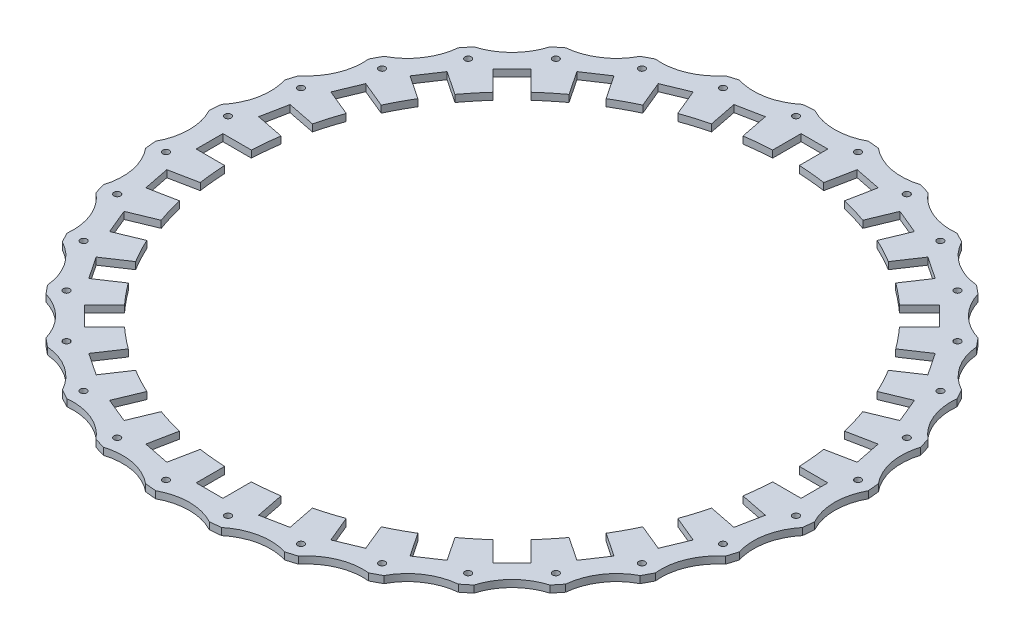
from build123d import *

# Parameters (mm, degrees)
BOSS_EXTRUDE1_DEPTH = 3.175
SKETCH4_R           = 1.4732
CUT_EXTRUDE1_DEPTH  = 211.364711432
CIRPATTERN1_COUNT   = 32


with BuildPart() as part:
    # Sketch1 → Boss-Extrude1 (new body)
    with BuildSketch(Plane(origin=(0, 0, 0), x_dir=(1, 0, 0), z_dir=(0, 1, 0))):
        with BuildLine():
            ThreePointArc((148.73337082, -12.1031), (145.664402376, 0), (148.73337082, 12.1031))
            ThreePointArc((148.73337082, 12.1031), (148.506440838, 14.626607766), (148.236698481, 17.145898881))
            ThreePointArc((148.236698481, 17.145898881), (142.86550173, 28.417715166), (143.514303128, 40.886983535))
            ThreePointArc((143.514303128, 40.886983535), (142.7994216, 43.317730963), (142.043372952, 45.735990483))
            ThreePointArc((142.043372952, 45.735990483), (134.576359971, 55.743353475), (132.780061251, 68.099603222))
            ThreePointArc((132.780061251, 68.099603222), (131.604700672, 70.344178053), (130.391400259, 72.568473619))
            ThreePointArc((130.391400259, 72.568473619), (121.11552417, 80.926805971), (116.943156085, 92.695193349))
            ThreePointArc((116.943156085, 92.695193349), (115.352484903, 94.667337829), (113.728559179, 96.612191012))
            ThreePointArc((113.728559179, 96.612191012), (103.000286698, 103.000286698), (96.612191012, 113.728559179))
            ThreePointArc((96.612191012, 113.728559179), (94.667337829, 115.352484903), (92.695193349, 116.943156085))
            ThreePointArc((92.695193349, 116.943156085), (80.926805971, 121.11552417), (72.568473619, 130.391400259))
            ThreePointArc((72.568473619, 130.391400259), (70.344178053, 131.604700672), (68.099603222, 132.780061251))
            ThreePointArc((68.099603222, 132.780061251), (55.743353475, 134.576359971), (45.735990483, 142.043372952))
            ThreePointArc((45.735990483, 142.043372952), (43.317730963, 142.7994216), (40.886983535, 143.514303128))
            ThreePointArc((40.886983535, 143.514303128), (28.417715166, 142.86550173), (17.145898881, 148.236698481))
            ThreePointArc((17.145898881, 148.236698481), (14.626607766, 148.506440838), (12.1031, 148.73337082))
            ThreePointArc((12.1031, 148.73337082), (0, 145.664402376), (-12.1031, 148.73337082))
            ThreePointArc((-12.1031, 148.73337082), (-14.626607766, 148.506440838), (-17.145898881, 148.236698481))
            ThreePointArc((-17.145898881, 148.236698481), (-28.417715166, 142.86550173), (-40.886983535, 143.514303128))
            ThreePointArc((-40.886983535, 143.514303128), (-43.317730963, 142.7994216), (-45.735990483, 142.043372952))
            ThreePointArc((-45.735990483, 142.043372952), (-55.743353475, 134.576359971), (-68.099603222, 132.780061251))
            ThreePointArc((-68.099603222, 132.780061251), (-70.344178053, 131.604700672), (-72.568473619, 130.391400259))
            ThreePointArc((-72.568473619, 130.391400259), (-80.926805971, 121.11552417), (-92.695193349, 116.943156085))
            ThreePointArc((-92.695193349, 116.943156085), (-94.667337829, 115.352484903), (-96.612191012, 113.728559179))
            ThreePointArc((-96.612191012, 113.728559179), (-103.000286698, 103.000286698), (-113.728559179, 96.612191012))
            ThreePointArc((-113.728559179, 96.612191012), (-115.352484903, 94.667337829), (-116.943156085, 92.695193349))
            ThreePointArc((-116.943156085, 92.695193349), (-121.11552417, 80.926805971), (-130.391400259, 72.568473619))
            ThreePointArc((-130.391400259, 72.568473619), (-131.604700672, 70.344178053), (-132.780061251, 68.099603222))
            ThreePointArc((-132.780061251, 68.099603222), (-134.576359971, 55.743353475), (-142.043372952, 45.735990483))
            ThreePointArc((-142.043372952, 45.735990483), (-142.7994216, 43.317730963), (-143.514303128, 40.886983535))
            ThreePointArc((-143.514303128, 40.886983535), (-142.86550173, 28.417715166), (-148.236698481, 17.145898881))
            ThreePointArc((-148.236698481, 17.145898881), (-148.506440838, 14.626607766), (-148.73337082, 12.1031))
            ThreePointArc((-148.73337082, 12.1031), (-145.664402376, 0), (-148.73337082, -12.1031))
            ThreePointArc((-148.73337082, -12.1031), (-148.506440838, -14.626607766), (-148.236698481, -17.145898881))
            ThreePointArc((-148.236698481, -17.145898881), (-142.86550173, -28.417715166), (-143.514303128, -40.886983535))
            ThreePointArc((-143.514303128, -40.886983535), (-142.7994216, -43.317730963), (-142.043372952, -45.735990483))
            ThreePointArc((-142.043372952, -45.735990483), (-134.576359971, -55.743353475), (-132.780061251, -68.099603222))
            ThreePointArc((-132.780061251, -68.099603222), (-131.604700672, -70.344178053), (-130.391400259, -72.568473619))
            ThreePointArc((-130.391400259, -72.568473619), (-121.11552417, -80.926805971), (-116.943156085, -92.695193349))
            ThreePointArc((-116.943156085, -92.695193349), (-115.352484903, -94.667337829), (-113.728559179, -96.612191012))
            ThreePointArc((-113.728559179, -96.612191012), (-103.000286698, -103.000286698), (-96.612191012, -113.728559179))
            ThreePointArc((-96.612191012, -113.728559179), (-94.667337829, -115.352484903), (-92.695193349, -116.943156085))
            ThreePointArc((-92.695193349, -116.943156085), (-80.926805971, -121.11552417), (-72.568473619, -130.391400259))
            ThreePointArc((-72.568473619, -130.391400259), (-70.344178053, -131.604700672), (-68.099603222, -132.780061251))
            ThreePointArc((-68.099603222, -132.780061251), (-55.743353475, -134.576359971), (-45.735990483, -142.043372952))
            ThreePointArc((-45.735990483, -142.043372952), (-43.317730963, -142.7994216), (-40.886983535, -143.514303128))
            ThreePointArc((-40.886983535, -143.514303128), (-28.417715166, -142.86550173), (-17.145898881, -148.236698481))
            ThreePointArc((-17.145898881, -148.236698481), (-14.626607766, -148.506440838), (-12.1031, -148.73337082))
            ThreePointArc((-12.1031, -148.73337082), (0, -145.664402376), (12.1031, -148.73337082))
            ThreePointArc((12.1031, -148.73337082), (14.626607766, -148.506440838), (17.145898881, -148.236698481))
            ThreePointArc((17.145898881, -148.236698481), (28.417715166, -142.86550173), (40.886983535, -143.514303128))
            ThreePointArc((40.886983535, -143.514303128), (43.317730963, -142.7994216), (45.735990483, -142.043372952))
            ThreePointArc((45.735990483, -142.043372952), (55.743353475, -134.576359971), (68.099603222, -132.780061251))
            ThreePointArc((68.099603222, -132.780061251), (70.344178053, -131.604700672), (72.568473619, -130.391400259))
            ThreePointArc((72.568473619, -130.391400259), (80.926805971, -121.11552417), (92.695193349, -116.943156085))
            ThreePointArc((92.695193349, -116.943156085), (94.667337829, -115.352484903), (96.612191012, -113.728559179))
            ThreePointArc((96.612191012, -113.728559179), (103.000286698, -103.000286698), (113.728559179, -96.612191012))
            ThreePointArc((113.728559179, -96.612191012), (115.352484903, -94.667337829), (116.943156085, -92.695193349))
            ThreePointArc((116.943156085, -92.695193349), (121.11552417, -80.926805971), (130.391400259, -72.568473619))
            ThreePointArc((130.391400259, -72.568473619), (131.604700672, -70.344178053), (132.780061251, -68.099603222))
            ThreePointArc((132.780061251, -68.099603222), (134.576359971, -55.743353475), (142.043372952, -45.735990483))
            ThreePointArc((142.043372952, -45.735990483), (142.7994216, -43.317730963), (143.514303128, -40.886983535))
            ThreePointArc((143.514303128, -40.886983535), (142.86550173, -28.417715166), (148.236698481, -17.145898881))
            ThreePointArc((148.236698481, -17.145898881), (148.506440838, -14.626607766), (148.73337082, -12.1031))
        make_face()
        with BuildLine():
            ThreePointArc((122.4784121, 18.211787242), (123.22874878, 12.136972401), (123.677967192, 6.0325))
            Line((123.677967192, 6.0325), (136.525, 6.0325))
            Line((136.525, 6.0325), (136.525, -6.0325))
            Line((136.525, -6.0325), (123.677967192, -6.0325))
            ThreePointArc((123.677967192, -6.0325), (123.22874878, -12.136972401), (122.4784121, -18.211787242))
            Line((122.4784121, -18.211787242), (135.078592775, -20.718119009))
            Line((135.078592775, -20.718119009), (132.724828039, -32.551293417))
            Line((132.724828039, -32.551293417), (120.124647365, -30.04496165))
            ThreePointArc((120.124647365, -30.04496165), (118.493137072, -35.944500161), (116.572080317, -41.756205713))
            Line((116.572080317, -41.756205713), (128.441190982, -46.672552324))
            Line((128.441190982, -46.672552324), (123.82411537, -57.819158884))
            Line((123.82411537, -57.819158884), (111.955004706, -52.902812273))
            ThreePointArc((111.955004706, -52.902812273), (109.203900558, -58.370700937), (106.185948862, -63.695956616))
            Line((106.185948862, -63.695956616), (116.86786625, -70.833385627))
            Line((116.86786625, -70.833385627), (110.164911389, -80.865066499))
            Line((110.164911389, -80.865066499), (99.482994001, -73.727637488))
            ThreePointArc((99.482994001, -73.727637488), (95.718019388, -78.553748412), (91.719150942, -83.187907627))
            Line((91.719150942, -83.187907627), (100.803374959, -92.272131644))
            Line((100.803374959, -92.272131644), (92.272131644, -100.803374959))
            Line((92.272131644, -100.803374959), (83.187907627, -91.719150942))
            ThreePointArc((83.187907627, -91.719150942), (78.553748412, -95.718019388), (73.727637488, -99.482994001))
            Line((73.727637488, -99.482994001), (80.865066499, -110.164911389))
            Line((80.865066499, -110.164911389), (70.833385627, -116.86786625))
            Line((70.833385627, -116.86786625), (63.695956616, -106.185948862))
            ThreePointArc((63.695956616, -106.185948862), (58.370700937, -109.203900558), (52.902812273, -111.955004706))
            Line((52.902812273, -111.955004706), (57.819158884, -123.82411537))
            Line((57.819158884, -123.82411537), (46.672552324, -128.441190982))
            Line((46.672552324, -128.441190982), (41.756205713, -116.572080317))
            ThreePointArc((41.756205713, -116.572080317), (35.944500161, -118.493137072), (30.04496165, -120.124647365))
            Line((30.04496165, -120.124647365), (32.551293417, -132.724828039))
            Line((32.551293417, -132.724828039), (20.718119009, -135.078592775))
            Line((20.718119009, -135.078592775), (18.211787242, -122.4784121))
            ThreePointArc((18.211787242, -122.4784121), (12.136972401, -123.22874878), (6.0325, -123.677967192))
            Line((6.0325, -123.677967192), (6.0325, -136.525))
            Line((6.0325, -136.525), (-6.0325, -136.525))
            Line((-6.0325, -136.525), (-6.0325, -123.677967192))
            ThreePointArc((-6.0325, -123.677967192), (-12.136972401, -123.22874878), (-18.211787242, -122.4784121))
            Line((-18.211787242, -122.4784121), (-20.718119009, -135.078592775))
            Line((-20.718119009, -135.078592775), (-32.551293417, -132.724828039))
            Line((-32.551293417, -132.724828039), (-30.04496165, -120.124647365))
            ThreePointArc((-30.04496165, -120.124647365), (-35.944500161, -118.493137072), (-41.756205713, -116.572080317))
            Line((-41.756205713, -116.572080317), (-46.672552324, -128.441190982))
            Line((-46.672552324, -128.441190982), (-57.819158884, -123.82411537))
            Line((-57.819158884, -123.82411537), (-52.902812273, -111.955004706))
            ThreePointArc((-52.902812273, -111.955004706), (-58.370700937, -109.203900558), (-63.695956616, -106.185948862))
            Line((-63.695956616, -106.185948862), (-70.833385627, -116.86786625))
            Line((-70.833385627, -116.86786625), (-80.865066499, -110.164911389))
            Line((-80.865066499, -110.164911389), (-73.727637488, -99.482994001))
            ThreePointArc((-73.727637488, -99.482994001), (-78.553748412, -95.718019388), (-83.187907627, -91.719150942))
            Line((-83.187907627, -91.719150942), (-92.272131644, -100.803374959))
            Line((-92.272131644, -100.803374959), (-100.803374959, -92.272131644))
            Line((-100.803374959, -92.272131644), (-91.719150942, -83.187907627))
            ThreePointArc((-91.719150942, -83.187907627), (-95.718019388, -78.553748412), (-99.482994001, -73.727637488))
            Line((-99.482994001, -73.727637488), (-110.164911389, -80.865066499))
            Line((-110.164911389, -80.865066499), (-116.86786625, -70.833385627))
            Line((-116.86786625, -70.833385627), (-106.185948862, -63.695956616))
            ThreePointArc((-106.185948862, -63.695956616), (-109.203900558, -58.370700937), (-111.955004706, -52.902812273))
            Line((-111.955004706, -52.902812273), (-123.82411537, -57.819158884))
            Line((-123.82411537, -57.819158884), (-128.441190982, -46.672552324))
            Line((-128.441190982, -46.672552324), (-116.572080317, -41.756205713))
            ThreePointArc((-116.572080317, -41.756205713), (-118.493137072, -35.944500161), (-120.124647365, -30.04496165))
            Line((-120.124647365, -30.04496165), (-132.724828039, -32.551293417))
            Line((-132.724828039, -32.551293417), (-135.078592775, -20.718119009))
            Line((-135.078592775, -20.718119009), (-122.4784121, -18.211787242))
            ThreePointArc((-122.4784121, -18.211787242), (-123.22874878, -12.136972401), (-123.677967192, -6.0325))
            Line((-123.677967192, -6.0325), (-136.525, -6.0325))
            Line((-136.525, -6.0325), (-136.525, 6.0325))
            Line((-136.525, 6.0325), (-123.677967192, 6.0325))
            ThreePointArc((-123.677967192, 6.0325), (-123.22874878, 12.136972401), (-122.4784121, 18.211787242))
            Line((-122.4784121, 18.211787242), (-135.078592775, 20.718119009))
            Line((-135.078592775, 20.718119009), (-132.724828039, 32.551293417))
            Line((-132.724828039, 32.551293417), (-120.124647365, 30.04496165))
            ThreePointArc((-120.124647365, 30.04496165), (-118.493137072, 35.944500161), (-116.572080317, 41.756205713))
            Line((-116.572080317, 41.756205713), (-128.441190982, 46.672552324))
            Line((-128.441190982, 46.672552324), (-123.82411537, 57.819158884))
            Line((-123.82411537, 57.819158884), (-111.955004706, 52.902812273))
            ThreePointArc((-111.955004706, 52.902812273), (-109.203900558, 58.370700937), (-106.185948862, 63.695956616))
            Line((-106.185948862, 63.695956616), (-116.86786625, 70.833385627))
            Line((-116.86786625, 70.833385627), (-110.164911389, 80.865066499))
            Line((-110.164911389, 80.865066499), (-99.482994001, 73.727637488))
            ThreePointArc((-99.482994001, 73.727637488), (-95.718019388, 78.553748412), (-91.719150942, 83.187907627))
            Line((-91.719150942, 83.187907627), (-100.803374959, 92.272131644))
            Line((-100.803374959, 92.272131644), (-92.272131644, 100.803374959))
            Line((-92.272131644, 100.803374959), (-83.187907627, 91.719150942))
            ThreePointArc((-83.187907627, 91.719150942), (-78.553748412, 95.718019388), (-73.727637488, 99.482994001))
            Line((-73.727637488, 99.482994001), (-80.865066499, 110.164911389))
            Line((-80.865066499, 110.164911389), (-70.833385627, 116.86786625))
            Line((-70.833385627, 116.86786625), (-63.695956616, 106.185948862))
            ThreePointArc((-63.695956616, 106.185948862), (-58.370700937, 109.203900558), (-52.902812273, 111.955004706))
            Line((-52.902812273, 111.955004706), (-57.819158884, 123.82411537))
            Line((-57.819158884, 123.82411537), (-46.672552324, 128.441190982))
            Line((-46.672552324, 128.441190982), (-41.756205713, 116.572080317))
            ThreePointArc((-41.756205713, 116.572080317), (-35.944500161, 118.493137072), (-30.04496165, 120.124647365))
            Line((-30.04496165, 120.124647365), (-32.551293417, 132.724828039))
            Line((-32.551293417, 132.724828039), (-20.718119009, 135.078592775))
            Line((-20.718119009, 135.078592775), (-18.211787242, 122.4784121))
            ThreePointArc((-18.211787242, 122.4784121), (-12.136972401, 123.22874878), (-6.0325, 123.677967192))
            Line((-6.0325, 123.677967192), (-6.0325, 136.525))
            Line((-6.0325, 136.525), (6.0325, 136.525))
            Line((6.0325, 136.525), (6.0325, 123.677967192))
            ThreePointArc((6.0325, 123.677967192), (12.136972401, 123.22874878), (18.211787242, 122.4784121))
            Line((18.211787242, 122.4784121), (20.718119009, 135.078592775))
            Line((20.718119009, 135.078592775), (32.551293417, 132.724828039))
            Line((32.551293417, 132.724828039), (30.04496165, 120.124647365))
            ThreePointArc((30.04496165, 120.124647365), (35.944500161, 118.493137072), (41.756205713, 116.572080317))
            Line((41.756205713, 116.572080317), (46.672552324, 128.441190982))
            Line((46.672552324, 128.441190982), (57.819158884, 123.82411537))
            Line((57.819158884, 123.82411537), (52.902812273, 111.955004706))
            ThreePointArc((52.902812273, 111.955004706), (58.370700937, 109.203900558), (63.695956616, 106.185948862))
            Line((63.695956616, 106.185948862), (70.833385627, 116.86786625))
            Line((70.833385627, 116.86786625), (80.865066499, 110.164911389))
            Line((80.865066499, 110.164911389), (73.727637488, 99.482994001))
            ThreePointArc((73.727637488, 99.482994001), (78.553748412, 95.718019388), (83.187907627, 91.719150942))
            Line((83.187907627, 91.719150942), (92.272131644, 100.803374959))
            Line((92.272131644, 100.803374959), (100.803374959, 92.272131644))
            Line((100.803374959, 92.272131644), (91.719150942, 83.187907627))
            ThreePointArc((91.719150942, 83.187907627), (95.718019388, 78.553748412), (99.482994001, 73.727637488))
            Line((99.482994001, 73.727637488), (110.164911389, 80.865066499))
            Line((110.164911389, 80.865066499), (116.86786625, 70.833385627))
            Line((116.86786625, 70.833385627), (106.185948862, 63.695956616))
            ThreePointArc((106.185948862, 63.695956616), (109.203900558, 58.370700937), (111.955004706, 52.902812273))
            Line((111.955004706, 52.902812273), (123.82411537, 57.819158884))
            Line((123.82411537, 57.819158884), (128.441190982, 46.672552324))
            Line((128.441190982, 46.672552324), (116.572080317, 41.756205713))
            ThreePointArc((116.572080317, 41.756205713), (118.493137072, 35.944500161), (120.124647365, 30.04496165))
            Line((120.124647365, 30.04496165), (132.724828039, 32.551293417))
            Line((132.724828039, 32.551293417), (135.078592775, 20.718119009))
            Line((135.078592775, 20.718119009), (122.4784121, 18.211787242))
        make_face(mode=Mode.SUBTRACT)
    extrude(amount=BOSS_EXTRUDE1_DEPTH)

    # Sketch4 → Cut-Extrude1 (cut, through all)
    with BuildSketch(Plane(origin=(0, 3.175, 0), x_dir=(1, 0, 0), z_dir=(0, 1, 0))):
        with Locations((142.187017823, 14.004198925)):
            Circle(SKETCH4_R)
    cut_extrude1 = extrude(amount=-CUT_EXTRUDE1_DEPTH, mode=Mode.SUBTRACT)

    # CirPattern1: Cut-Extrude1 ×32 about axis
    cirpattern1_axis = Axis((0, 50, 0), (0, -1, 0))
    for i in range(1, CIRPATTERN1_COUNT):
        add(cut_extrude1.rotate(cirpattern1_axis, i * 360 / CIRPATTERN1_COUNT), mode=Mode.SUBTRACT)


solid = part.part
